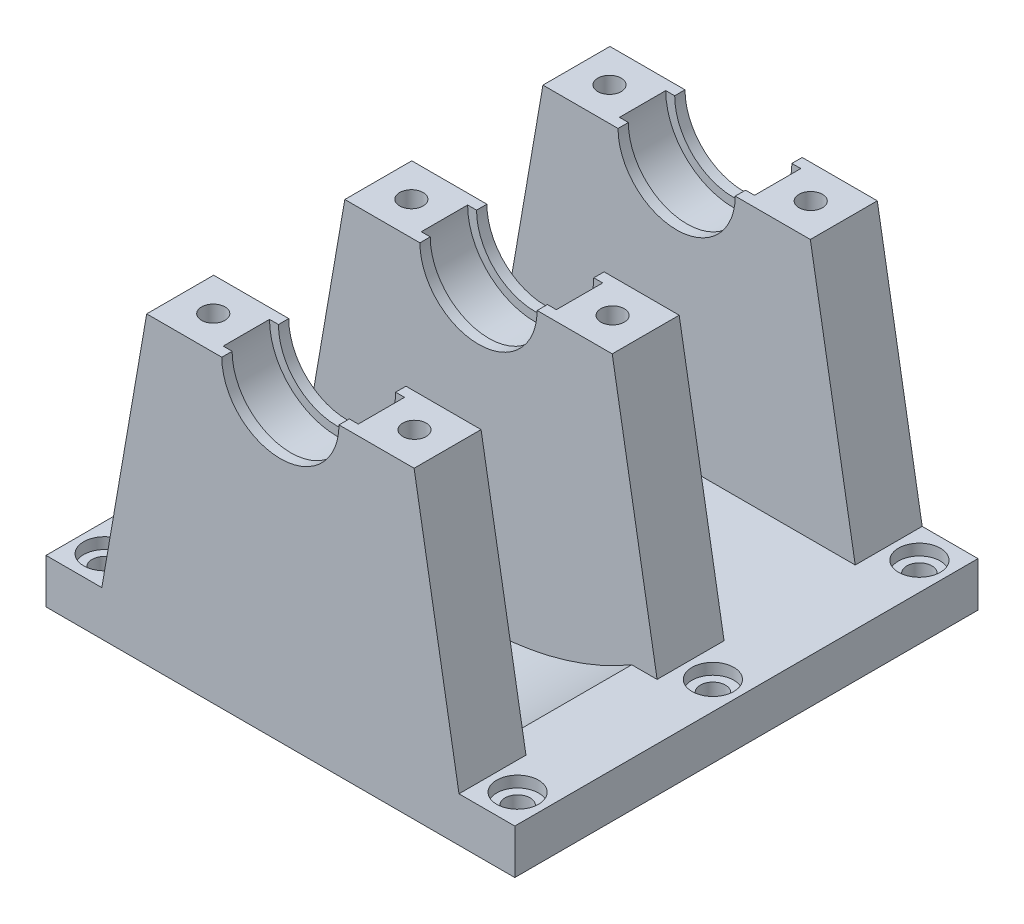
from build123d import *

# Parameters (mm, degrees)
ESTRUSIONE_ESTRUSIONE1_DEPTH  = 12
ESTRUSIONE_ESTRUSIONE2_START  = -1.85
ESTRUSIONE_ESTRUSIONE2_DEPTH  = 1.85
ESTRUSIONE_ESTRUSIONE3_DEPTH  = 1.85
ESTRUSIONE_ESTRUSIONE4_DEPTH  = 23.5
ESTRUSIONE_ESTRUSIONE5_START  = 1.85
ESTRUSIONE_ESTRUSIONE5_DEPTH  = 1.85
ESTRUSIONE_ESTRUSIONE6_START  = 8.3
ESTRUSIONE_ESTRUSIONE6_DEPTH  = 8.3
ESTRUSIONE_ESTRUSIONE7_START  = 1.85
ESTRUSIONE_ESTRUSIONE7_DEPTH  = 1.85
ESTRUSIONE_ESTRUSIONE8_DEPTH  = 23.5
ESTRUSIONE_ESTRUSIONE9_START  = 1.85
ESTRUSIONE_ESTRUSIONE9_DEPTH  = 1.85
ESTRUSIONE_ESTRUSIONE10_START = 8.3
ESTRUSIONE_ESTRUSIONE10_DEPTH = 8.3
ESTRUSIONE_ESTRUSIONE11_START = 1.85
ESTRUSIONE_ESTRUSIONE11_DEPTH = 1.85
SCHIZZO12_R                   = 2.25
TAGLIO_ESTRUSIONE1_DEPTH      = 95.695564838
SCHIZZO13_R                   = 2.1
TAGLIO_ESTRUSIONE2_DEPTH      = 6
SCHIZZO15_R                   = 2.1
TAGLIO_ESTRUSIONE4_DEPTH      = 5
SCHIZZO16_R                   = 3.75
TAGLIO_ESTRUSIONE5_DEPTH      = 2


with BuildPart() as part:
    # Schizzo1 → Estrusione-Estrusione1 (new body)
    with BuildSketch(Plane.XY):
        with BuildLine():
            Line((-12.1, 0), (-21, 0))
            Line((-21, 0), (-21, -17.1))
            Line((-21, -17.1), (21, -17.1))
            Line((21, -17.1), (21, 0))
            Line((21, 0), (12.1, 0))
            ThreePointArc((12.1, 0), (0, -12.1), (-12.1, 0))
        make_face()
        Polygon((-42, -46.5), (-42, -54.5), (42, -54.5), (42, -46.5), (32, -46.5), (23.95754717, 0), (21, 0), (21, -17.1), (-21, -17.1), (-21, 0), (-23.95754717, 0), (-32, -46.5), align=None)
    extrude(amount=ESTRUSIONE_ESTRUSIONE1_DEPTH)

    # Schizzo2 → Estrusione-Estrusione2 (add)
    with BuildSketch(Plane.XY.offset(12).offset(ESTRUSIONE_ESTRUSIONE2_START)):
        with BuildLine():
            Line((12.1, 0), (10.5, 0))
            ThreePointArc((10.5, 0), (0, -10.5), (-10.5, 0))
            Line((-10.5, 0), (-12.1, 0))
            ThreePointArc((-12.1, 0), (0, -12.1), (12.1, 0))
        make_face()
    extrude(amount=ESTRUSIONE_ESTRUSIONE2_DEPTH)

    # Schizzo3 → Estrusione-Estrusione3 (add)
    with BuildSketch(Plane(origin=(0, 0, 0), x_dir=(-1, 0, 0), z_dir=(0, 0, -1))):
        with BuildLine():
            Line((12.1, 0), (10.5, 0))
            ThreePointArc((10.5, 0), (0, -10.5), (-10.5, 0))
            Line((-10.5, 0), (-12.1, 0))
            ThreePointArc((-12.1, 0), (0, -12.1), (12.1, 0))
        make_face()
    extrude(amount=-ESTRUSIONE_ESTRUSIONE3_DEPTH)

    # Schizzo4 → Estrusione-Estrusione4 (add)
    with BuildSketch(Plane(origin=(0, 0, 0), x_dir=(-1, 0, 0), z_dir=(0, 0, -1))):
        with BuildLine():
            Line((-27.454507827, -46.5), (-32, -46.5))
            Line((-32, -46.5), (-42, -46.5))
            Line((-42, -46.5), (-42, -54.5))
            Line((-42, -54.5), (42, -54.5))
            Line((42, -54.5), (42, -46.5))
            Line((42, -46.5), (32, -46.5))
            Line((32, -46.5), (27.454507827, -46.5))
            ThreePointArc((27.454507827, -46.5), (0, -54), (-27.454507827, -46.5))
        make_face()
    extrude(amount=ESTRUSIONE_ESTRUSIONE4_DEPTH)

    # Schizzo5 → Estrusione-Estrusione5 (add)
    with BuildSketch(Plane(origin=(0, 0, -23.5), x_dir=(-1, 0, 0), z_dir=(0, 0, -1)).offset(ESTRUSIONE_ESTRUSIONE5_START)):
        with BuildLine():
            Line((23.95754717, 0), (10.5, 0))
            ThreePointArc((10.5, 0), (0, -10.5), (-10.5, 0))
            Line((-10.5, 0), (-23.95754717, 0))
            Line((-23.95754717, 0), (-32, -46.5))
            Line((-32, -46.5), (-42, -46.5))
            Line((-42, -46.5), (-42, -54.5))
            Line((-42, -54.5), (42, -54.5))
            Line((42, -54.5), (42, -46.5))
            Line((42, -46.5), (32, -46.5))
            Line((32, -46.5), (23.95754717, 0))
        make_face()
    extrude(amount=-ESTRUSIONE_ESTRUSIONE5_DEPTH)

    # Schizzo6 → Estrusione-Estrusione6 (add)
    with BuildSketch(Plane(origin=(0, 0, -25.35), x_dir=(-1, 0, 0), z_dir=(0, 0, -1)).offset(ESTRUSIONE_ESTRUSIONE6_START)):
        with BuildLine():
            ThreePointArc((12.1, 0), (0, -12.1), (-12.1, 0))
            Line((-12.1, 0), (-23.95754717, 0))
            Line((-23.95754717, 0), (-32, -46.5))
            Line((-32, -46.5), (-42, -46.5))
            Line((-42, -46.5), (-42, -54.5))
            Line((-42, -54.5), (42, -54.5))
            Line((42, -54.5), (42, -46.5))
            Line((42, -46.5), (32, -46.5))
            Line((32, -46.5), (23.95754717, 0))
            Line((23.95754717, 0), (12.1, 0))
        make_face()
    extrude(amount=-ESTRUSIONE_ESTRUSIONE6_DEPTH)

    # Schizzo7 → Estrusione-Estrusione7 (add)
    with BuildSketch(Plane(origin=(0, 0, -33.65), x_dir=(-1, 0, 0), z_dir=(0, 0, -1)).offset(ESTRUSIONE_ESTRUSIONE7_START)):
        with BuildLine():
            Line((23.95754717, 0), (10.5, 0))
            ThreePointArc((10.5, 0), (0, -10.5), (-10.5, 0))
            Line((-10.5, 0), (-23.95754717, 0))
            Line((-23.95754717, 0), (-32, -46.5))
            Line((-32, -46.5), (-42, -46.5))
            Line((-42, -46.5), (-42, -54.5))
            Line((-42, -54.5), (42, -54.5))
            Line((42, -54.5), (42, -46.5))
            Line((42, -46.5), (32, -46.5))
            Line((32, -46.5), (23.95754717, 0))
        make_face()
    extrude(amount=-ESTRUSIONE_ESTRUSIONE7_DEPTH)

    # Schizzo8 → Estrusione-Estrusione8 (add)
    with BuildSketch(Plane(origin=(0, 0, -35.5), x_dir=(-1, 0, 0), z_dir=(0, 0, -1))):
        Polygon((-32, -46.5), (32, -46.5), (42, -46.5), (42, -54.5), (-42, -54.5), (-42, -46.5), align=None)
    extrude(amount=ESTRUSIONE_ESTRUSIONE8_DEPTH)

    # Schizzo9 → Estrusione-Estrusione9 (add)
    with BuildSketch(Plane(origin=(0, 0, -59), x_dir=(-1, 0, 0), z_dir=(0, 0, -1)).offset(ESTRUSIONE_ESTRUSIONE9_START)):
        with BuildLine():
            Line((23.95754717, 0), (10.5, 0))
            ThreePointArc((10.5, 0), (0, -10.5), (-10.5, 0))
            Line((-10.5, 0), (-23.95754717, 0))
            Line((-23.95754717, 0), (-32, -46.5))
            Line((-32, -46.5), (-42, -46.5))
            Line((-42, -46.5), (-42, -54.5))
            Line((-42, -54.5), (42, -54.5))
            Line((42, -54.5), (42, -46.5))
            Line((42, -46.5), (32, -46.5))
            Line((32, -46.5), (23.95754717, 0))
        make_face()
    extrude(amount=-ESTRUSIONE_ESTRUSIONE9_DEPTH)

    # Schizzo10 → Estrusione-Estrusione10 (add)
    with BuildSketch(Plane(origin=(0, 0, -60.85), x_dir=(-1, 0, 0), z_dir=(0, 0, -1)).offset(ESTRUSIONE_ESTRUSIONE10_START)):
        with BuildLine():
            ThreePointArc((12.1, 0), (0, -12.1), (-12.1, 0))
            Line((-12.1, 0), (-23.95754717, 0))
            Line((-23.95754717, 0), (-32, -46.5))
            Line((-32, -46.5), (-42, -46.5))
            Line((-42, -46.5), (-42, -54.5))
            Line((-42, -54.5), (42, -54.5))
            Line((42, -54.5), (42, -46.5))
            Line((42, -46.5), (32, -46.5))
            Line((32, -46.5), (23.95754717, 0))
            Line((23.95754717, 0), (12.1, 0))
        make_face()
    extrude(amount=-ESTRUSIONE_ESTRUSIONE10_DEPTH)

    # Schizzo11 → Estrusione-Estrusione11 (add)
    with BuildSketch(Plane(origin=(0, 0, -69.15), x_dir=(-1, 0, 0), z_dir=(0, 0, -1)).offset(ESTRUSIONE_ESTRUSIONE11_START)):
        with BuildLine():
            Line((23.95754717, 0), (10.5, 0))
            ThreePointArc((10.5, 0), (0, -10.5), (-10.5, 0))
            Line((-10.5, 0), (-23.95754717, 0))
            Line((-23.95754717, 0), (-32, -46.5))
            Line((-32, -46.5), (-42, -46.5))
            Line((-42, -46.5), (-42, -54.5))
            Line((-42, -54.5), (42, -54.5))
            Line((42, -54.5), (42, -46.5))
            Line((42, -46.5), (32, -46.5))
            Line((32, -46.5), (23.95754717, 0))
        make_face()
    extrude(amount=-ESTRUSIONE_ESTRUSIONE11_DEPTH)

    # Schizzo12 → Taglio-Estrusione1 (cut, through all)
    with BuildSketch(Plane(origin=(0, -46.5, 0), x_dir=(1, 0, 0), z_dir=(0, 1, 0))):
        with Locations(Location((37, -6.5, 0), (0, 0, 270))):
            Circle(SCHIZZO12_R)
        with Locations(Location((37, 28.5, 0), (0, 0, 270))):
            Circle(SCHIZZO12_R)
        with Locations(Location((37, 65.5, 0), (0, 0, 270))):
            Circle(SCHIZZO12_R)
        with Locations(Location((-37, -6.5, 0), (0, 0, 270))):
            Circle(SCHIZZO12_R)
        with Locations(Location((-37, 28.5, 0), (0, 0, 270))):
            Circle(SCHIZZO12_R)
        with Locations(Location((-37, 65.5, 0), (0, 0, 270))):
            Circle(SCHIZZO12_R)
    extrude(amount=-TAGLIO_ESTRUSIONE1_DEPTH, mode=Mode.SUBTRACT)

    # Schizzo13 → Taglio-Estrusione2 (cut)
    with BuildSketch(Plane(origin=(0, 0, 0), x_dir=(1, 0, 0), z_dir=(0, 1, 0))):
        with Locations(Location((18.028773585, -6, 0), (0, 0, 180))):
            Circle(SCHIZZO13_R)
        with Locations(Location((-18.028773585, -6, 0), (0, 0, 180))):
            Circle(SCHIZZO13_R)
        with Locations(Location((18.028773585, 29.5, 0), (0, 0, 180))):
            Circle(SCHIZZO13_R)
        with Locations(Location((-18.028773585, 29.5, 0), (0, 0, 180))):
            Circle(SCHIZZO13_R)
        with Locations(Location((18.028773585, 65, 0), (0, 0, 180))):
            Circle(SCHIZZO13_R)
        with Locations(Location((-18.028773585, 65, 0), (0, 0, 180))):
            Circle(SCHIZZO13_R)
    extrude(amount=-TAGLIO_ESTRUSIONE2_DEPTH, mode=Mode.SUBTRACT)

    # Schizzo15 → Taglio-Estrusione4 (cut)
    with BuildSketch(Plane(origin=(0, -6, 0), x_dir=(1, 0, 0), z_dir=(0, 1, 0))):
        with Locations(Location((-18.028773585, 65, 0), (0, 0, 180))):
            Circle(SCHIZZO15_R)
        with Locations(Location((18.028773585, 65, 0), (0, 0, 180))):
            Circle(SCHIZZO15_R)
        with Locations(Location((18.028773585, 29.5, 0), (0, 0, 180))):
            Circle(SCHIZZO15_R)
        with Locations(Location((-18.028773585, 29.5, 0), (0, 0, 180))):
            Circle(SCHIZZO15_R)
        with Locations(Location((-18.028773585, -6, 0), (0, 0, 180))):
            Circle(SCHIZZO15_R)
        with Locations(Location((18.028773585, -6, 0), (0, 0, 180))):
            Circle(SCHIZZO15_R)
    extrude(amount=-TAGLIO_ESTRUSIONE4_DEPTH, mode=Mode.SUBTRACT)

    # Schizzo16 → Taglio-Estrusione5 (cut)
    with BuildSketch(Plane(origin=(0, -46.5, 0), x_dir=(1, 0, 0), z_dir=(0, 1, 0))):
        with Locations(Location((37, -6.5, 0), (0, 0, 270))):
            Circle(SCHIZZO16_R)
        with Locations(Location((37, 28.5, 0), (0, 0, 270))):
            Circle(SCHIZZO16_R)
        with Locations(Location((37, 65.5, 0), (0, 0, 270))):
            Circle(SCHIZZO16_R)
        with Locations(Location((-37, 65.5, 0), (0, 0, 270))):
            Circle(SCHIZZO16_R)
        with Locations(Location((-37, 28.5, 0), (0, 0, 270))):
            Circle(SCHIZZO16_R)
        with Locations(Location((-37, -6.5, 0), (0, 0, 270))):
            Circle(SCHIZZO16_R)
    extrude(amount=-TAGLIO_ESTRUSIONE5_DEPTH, mode=Mode.SUBTRACT)


solid = part.part
